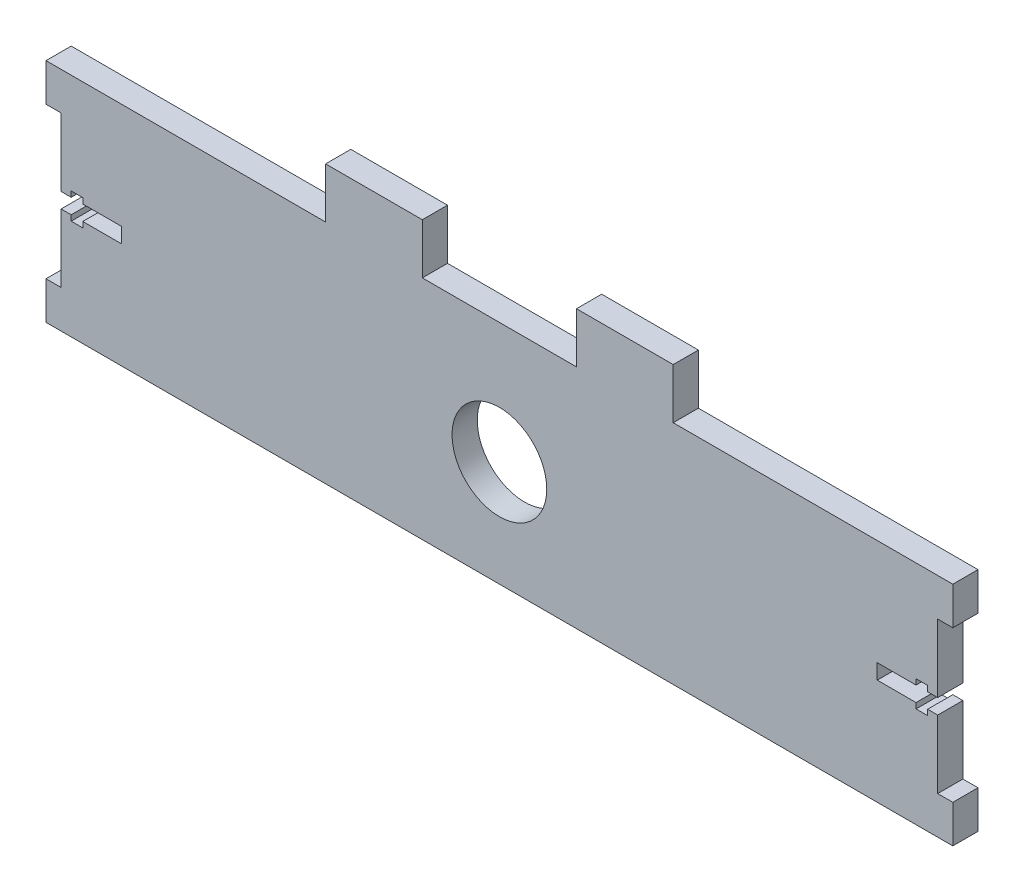
from build123d import *

# Parameters (mm, degrees)
ESQUISSE1_R        = 9.4
BOSS_EXTRU_1_DEPTH = 5


with BuildPart() as part:
    # Esquisse1 → Boss.-Extru.1 (new body)
    with BuildSketch(Plane.XY):
        Polygon((90, 45), (34.5, 45), (34.5, 55), (15.3, 55), (15.3, 45), (-15.3, 45), (-15.3, 55), (-34.5, 55), (-34.5, 45), (-90, 45), (-90, 37.5), (-87, 37.5), (-87, 24), (-85, 24), (-85, 25.1), (-82.7, 25.1), (-82.7, 24), (-75, 24), (-75, 21), (-82.7, 21), (-82.7, 19.9), (-85, 19.9), (-85, 21), (-87, 21), (-87, 7.5), (-90, 7.5), (-90, 0), (90, 0), (90, 7.5), (87, 7.5), (87, 21), (85, 21), (85, 19.9), (82.7, 19.9), (82.7, 21), (75, 21), (75, 24), (82.7, 24), (82.7, 25.1), (85, 25.1), (85, 24), (87, 24), (87, 37.5), (90, 37.5), align=None)
        with Locations((0, 21)):
            Circle(ESQUISSE1_R, mode=Mode.SUBTRACT)
    extrude(amount=BOSS_EXTRU_1_DEPTH)


solid = part.part
